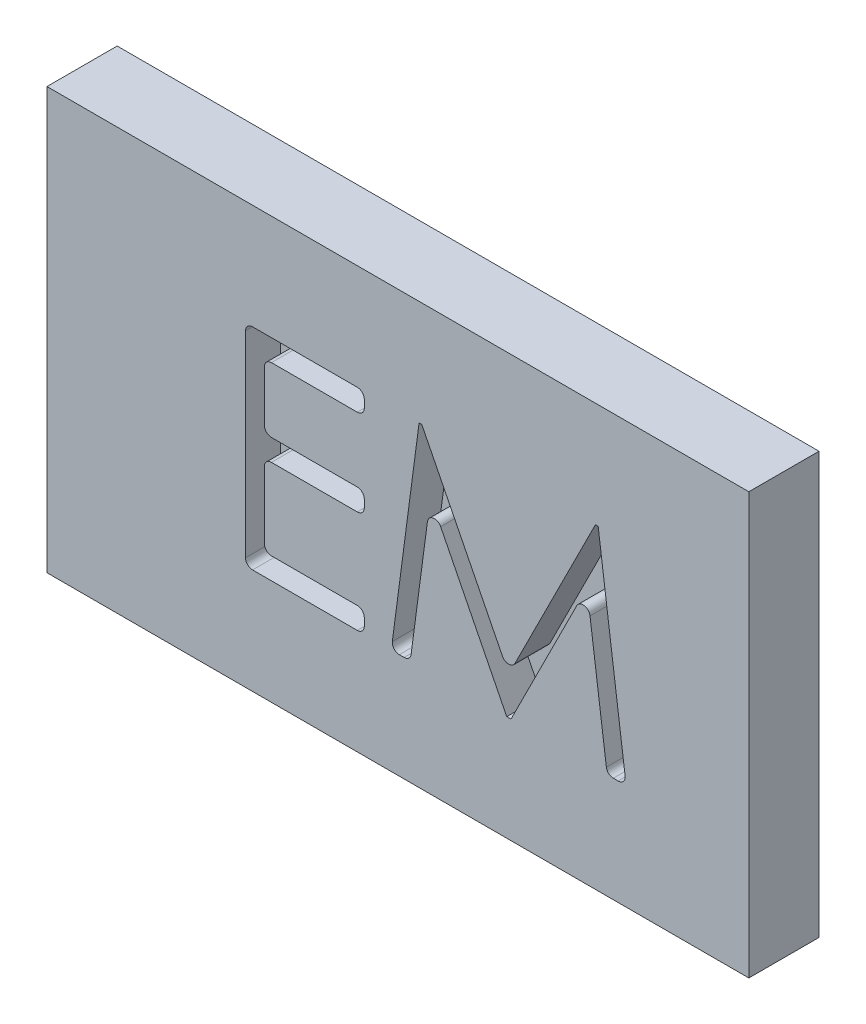
from build123d import *

# Parameters (mm, degrees)
SKETCH3_W           = 100
SKETCH3_H           = 60
BOSS_EXTRUDE3_DEPTH = 10
CUT_EXTRUDE1_START  = 10
CUT_EXTRUDE1_DEPTH  = 5
FILLET1_R           = 1


with BuildPart() as part:
    # Sketch3 → Boss-Extrude3 (new body)
    with BuildSketch(Plane.XY):
        with Locations((0, 30)):
            Rectangle(SKETCH3_W, SKETCH3_H)
    extrude(amount=BOSS_EXTRUDE3_DEPTH)

    # Sketch1<2> → Cut-Extrude1 (cut)
    with BuildSketch(Plane.XY.offset(CUT_EXTRUDE1_START)):
        Polygon((-21.712736005, 45), (-4.789659082, 45), (-4.789659082, 41.923076923), (-19.020428312, 41.923076923), (-19.020428312, 32.692307692), (-4.789659082, 32.692307692), (-4.789659082, 29.615384615), (-19.020428312, 29.615384615), (-19.020428312, 18.076923077), (-4.789659082, 18.076923077), (-4.789659082, 15), (-21.712736005, 15), align=None)
        Polygon((-0.943505235, 15), (3.016831303, 45), (3.401446688, 45), (15.787263995, 20.384615385), (28.143033226, 45), (28.533658226, 45), (32.518033226, 15), (29.813706303, 15), (26.941110149, 36.586538462), (16.111783226, 15), (15.504812072, 15), (4.633417841, 36.634615385), (1.766831303, 15), align=None)
    extrude(amount=-CUT_EXTRUDE1_DEPTH, mode=Mode.SUBTRACT)

    # Fillet1
    fillet1_edges = [part.edges().sort_by_distance(p)[0] for p in [
        (-4.789659082, 15, 7.5),
        (-21.712736005, 15, 7.5),
        (-21.712736005, 45, 7.5),
        (-4.789659082, 45, 7.5),
        (-4.789659082, 41.923076923, 7.5),
        (-19.020428312, 41.923076923, 7.5),
        (-19.020428312, 32.692307692, 7.5),
        (-4.789659082, 32.692307692, 7.5),
        (-4.789659082, 29.615384615, 7.5),
        (-19.020428312, 29.615384615, 7.5),
        (-19.020428312, 18.076923077, 7.5),
        (-4.789659082, 18.076923077, 7.5),
        (15.787263995, 20.384615385, 7.5),
        (32.518033226, 15, 7.5),
        (29.813706303, 15, 7.5),
        (26.941110149, 36.586538462, 7.5),
        (4.633417841, 36.634615385, 7.5),
        (1.766831303, 15, 7.5),
        (-0.943505235, 15, 7.5),
    ]]
    fillet(fillet1_edges, radius=FILLET1_R)


solid = part.part
